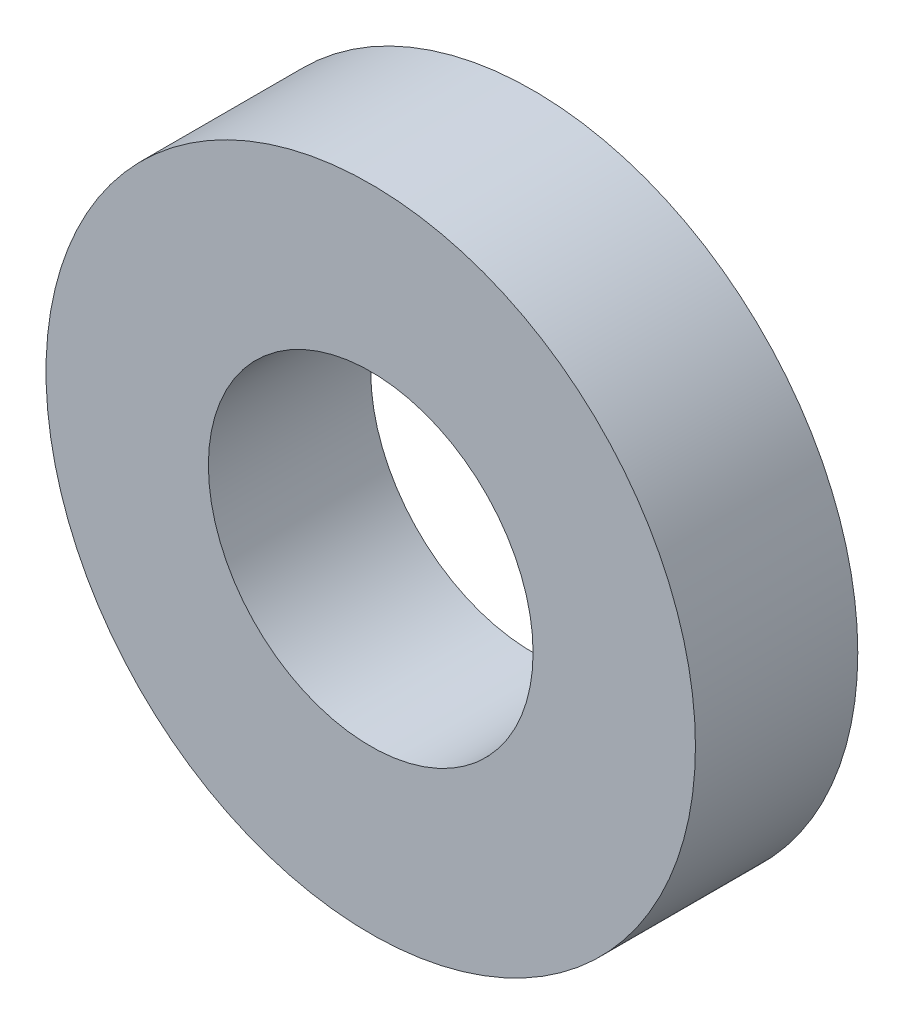
from build123d import *

# Parameters (mm, degrees)
SKETCH1_R           = 5.08
SKETCH1_R_2         = 2.54
BOSS_EXTRUDE1_DEPTH = 2.54


with BuildPart() as part:
    # Sketch1 → Boss-Extrude1 (new body)
    with BuildSketch(Plane.XY):
        Circle(SKETCH1_R)
        Circle(SKETCH1_R_2, mode=Mode.SUBTRACT)
    extrude(amount=BOSS_EXTRUDE1_DEPTH)


solid = part.part
